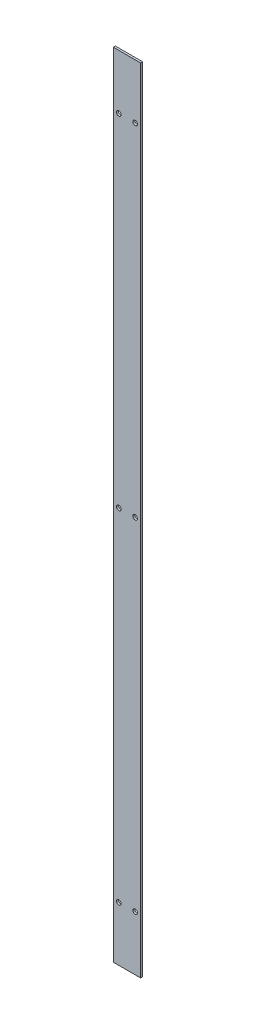
from build123d import *

# Parameters (mm, degrees)
MAIN_PROFILE_SKETCH_W = 20
MAIN_PROFILE_SKETCH_H = 580
MAIN_PROFILE_SKETCH_R = 1.7
MAIN_EXTRUSION_DEPTH  = 1.5


with BuildPart() as part:
    # Main Profile Sketch → Main Extrusion (new body)
    with BuildSketch(Plane.XY.offset(110)):
        with Locations((-140.5, 0)):
            Rectangle(MAIN_PROFILE_SKETCH_W, MAIN_PROFILE_SKETCH_H)
        with Locations((-146.5, -250)):
            Circle(MAIN_PROFILE_SKETCH_R, mode=Mode.SUBTRACT)
        with Locations((-134.5, -250)):
            Circle(MAIN_PROFILE_SKETCH_R, mode=Mode.SUBTRACT)
        with Locations((-146.5, 0)):
            Circle(MAIN_PROFILE_SKETCH_R, mode=Mode.SUBTRACT)
        with Locations((-146.5, 250)):
            Circle(MAIN_PROFILE_SKETCH_R, mode=Mode.SUBTRACT)
        with Locations((-134.5, 0)):
            Circle(MAIN_PROFILE_SKETCH_R, mode=Mode.SUBTRACT)
        with Locations((-134.5, 250)):
            Circle(MAIN_PROFILE_SKETCH_R, mode=Mode.SUBTRACT)
    extrude(amount=-MAIN_EXTRUSION_DEPTH)


solid = part.part
